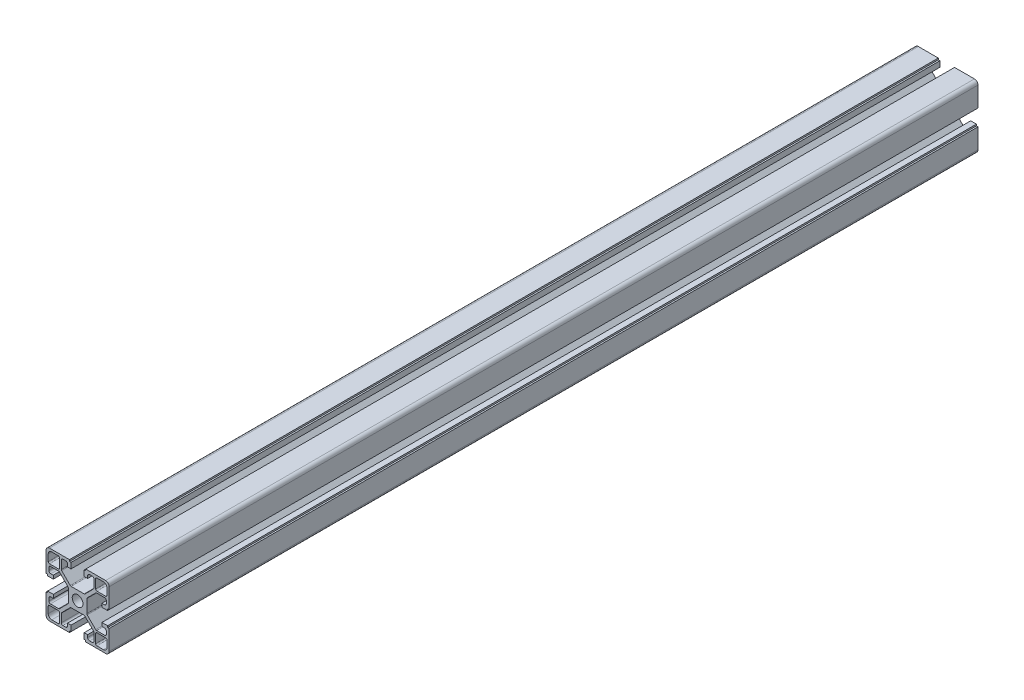
from build123d import *

# Parameters (mm, degrees)
SKETCH1_R           = 3.4
BOSS_EXTRUDE1_DEPTH = 713
SKETCH2_W           = 40
SKETCH2_H           = 163
CUT_EXTRUDE1_DEPTH  = 715.401147815


with BuildPart() as part:
    # Sketch1 → Boss-Extrude1 (new body)
    with BuildSketch(Plane.XY):
        with BuildLine():
            Line((20, 17.75), (20, 5.15))
            Line((20, 5.15), (19, 5.15))
            Line((19, 5.15), (19, 4.15))
            Line((19, 4.15), (15.4, 4.15))
            Line((15.4, 4.15), (15.4, 6.35))
            Line((15.4, 6.35), (16.95, 6.35))
            ThreePointArc((16.95, 6.35), (17.833883476, 6.716116524), (18.2, 7.6))
            Line((18.2, 7.6), (18.2, 9.3))
            ThreePointArc((18.2, 9.3), (17.907106781, 10.007106781), (17.2, 10.3))
            Line((17.2, 10.3), (12.03669957, 10.3))
            ThreePointArc((12.03669957, 10.3), (11.73040037, 10.239040459), (11.470780817, 10.065452001))
            Line((11.470780817, 10.065452001), (6.084081247, 4.674305984))
            ThreePointArc((6.084081247, 4.674305984), (5.910833239, 4.414848262), (5.85, 4.108853983))
            Line((5.85, 4.108853983), (5.85, -4.108853983))
            ThreePointArc((5.85, -4.108853983), (5.910833239, -4.414848262), (6.084081247, -4.674305984))
            Line((6.084081247, -4.674305984), (11.470780817, -10.065452001))
            ThreePointArc((11.470780817, -10.065452001), (11.73040037, -10.239040459), (12.03669957, -10.3))
            Line((12.03669957, -10.3), (17.2, -10.3))
            ThreePointArc((17.2, -10.3), (17.907106781, -10.007106781), (18.2, -9.3))
            Line((18.2, -9.3), (18.2, -7.6))
            ThreePointArc((18.2, -7.6), (17.833883476, -6.716116524), (16.95, -6.35))
            Line((16.95, -6.35), (15.4, -6.35))
            Line((15.4, -6.35), (15.4, -4.15))
            Line((15.4, -4.15), (19, -4.15))
            Line((19, -4.15), (19, -5.15))
            Line((19, -5.15), (20, -5.15))
            Line((20, -5.15), (20, -17.75))
            ThreePointArc((20, -17.75), (19.340990258, -19.340990258), (17.75, -20))
            Line((17.75, -20), (5.15, -20))
            Line((5.15, -20), (5.15, -19))
            Line((5.15, -19), (4.15, -19))
            Line((4.15, -19), (4.15, -15.4))
            Line((4.15, -15.4), (6.35, -15.4))
            Line((6.35, -15.4), (6.35, -16.95))
            ThreePointArc((6.35, -16.95), (6.716116524, -17.833883476), (7.6, -18.2))
            Line((7.6, -18.2), (9.3, -18.2))
            ThreePointArc((9.3, -18.2), (10.007106781, -17.907106781), (10.3, -17.2))
            Line((10.3, -17.2), (10.3, -12.054477022))
            ThreePointArc((10.3, -12.054477022), (10.239166761, -11.748482743), (10.065918753, -11.489025021))
            Line((10.065918753, -11.489025021), (4.665899173, -6.084547999))
            ThreePointArc((4.665899173, -6.084547999), (4.406279619, -5.910959541), (4.09998042, -5.85))
            Line((4.09998042, -5.85), (-4.09998042, -5.85))
            ThreePointArc((-4.09998042, -5.85), (-4.406279619, -5.910959541), (-4.665899173, -6.084547999))
            Line((-4.665899173, -6.084547999), (-10.065918753, -11.489025021))
            ThreePointArc((-10.065918753, -11.489025021), (-10.239166761, -11.748482743), (-10.3, -12.054477022))
            Line((-10.3, -12.054477022), (-10.3, -17.2))
            ThreePointArc((-10.3, -17.2), (-10.007106781, -17.907106781), (-9.3, -18.2))
            Line((-9.3, -18.2), (-7.6, -18.2))
            ThreePointArc((-7.6, -18.2), (-6.716116524, -17.833883476), (-6.35, -16.95))
            Line((-6.35, -16.95), (-6.35, -15.4))
            Line((-6.35, -15.4), (-4.15, -15.4))
            Line((-4.15, -15.4), (-4.15, -19))
            Line((-4.15, -19), (-5.15, -19))
            Line((-5.15, -19), (-5.15, -20))
            Line((-5.15, -20), (-17.75, -20))
            ThreePointArc((-17.75, -20), (-19.340990258, -19.340990258), (-20, -17.75))
            Line((-20, -17.75), (-20, -5.15))
            Line((-20, -5.15), (-19, -5.15))
            Line((-19, -5.15), (-19, -4.15))
            Line((-19, -4.15), (-15.4, -4.15))
            Line((-15.4, -4.15), (-15.4, -6.35))
            Line((-15.4, -6.35), (-16.95, -6.35))
            ThreePointArc((-16.95, -6.35), (-17.833883476, -6.716116524), (-18.2, -7.6))
            Line((-18.2, -7.6), (-18.2, -9.3))
            ThreePointArc((-18.2, -9.3), (-17.907106781, -10.007106781), (-17.2, -10.3))
            Line((-17.2, -10.3), (-12.03669957, -10.3))
            ThreePointArc((-12.03669957, -10.3), (-11.73040037, -10.239040459), (-11.470780817, -10.065452001))
            Line((-11.470780817, -10.065452001), (-6.084081247, -4.674305984))
            ThreePointArc((-6.084081247, -4.674305984), (-5.910833239, -4.414848262), (-5.85, -4.108853983))
            Line((-5.85, -4.108853983), (-5.85, 4.108853983))
            ThreePointArc((-5.85, 4.108853983), (-5.910833239, 4.414848262), (-6.084081247, 4.674305984))
            Line((-6.084081247, 4.674305984), (-11.470780817, 10.065452001))
            ThreePointArc((-11.470780817, 10.065452001), (-11.73040037, 10.239040459), (-12.03669957, 10.3))
            Line((-12.03669957, 10.3), (-17.2, 10.3))
            ThreePointArc((-17.2, 10.3), (-17.907106781, 10.007106781), (-18.2, 9.3))
            Line((-18.2, 9.3), (-18.2, 7.6))
            ThreePointArc((-18.2, 7.6), (-17.833883476, 6.716116524), (-16.95, 6.35))
            Line((-16.95, 6.35), (-15.4, 6.35))
            Line((-15.4, 6.35), (-15.4, 4.15))
            Line((-15.4, 4.15), (-19, 4.15))
            Line((-19, 4.15), (-19, 5.15))
            Line((-19, 5.15), (-20, 5.15))
            Line((-20, 5.15), (-20, 17.75))
            ThreePointArc((-20, 17.75), (-19.340990258, 19.340990258), (-17.75, 20))
            Line((-17.75, 20), (-5.15, 20))
            Line((-5.15, 20), (-5.15, 19))
            Line((-5.15, 19), (-4.15, 19))
            Line((-4.15, 19), (-4.15, 15.4))
            Line((-4.15, 15.4), (-6.35, 15.4))
            Line((-6.35, 15.4), (-6.35, 16.95))
            ThreePointArc((-6.35, 16.95), (-6.716116524, 17.833883476), (-7.6, 18.2))
            Line((-7.6, 18.2), (-9.3, 18.2))
            ThreePointArc((-9.3, 18.2), (-10.007106781, 17.907106781), (-10.3, 17.2))
            Line((-10.3, 17.2), (-10.3, 12.054477022))
            ThreePointArc((-10.3, 12.054477022), (-10.239166761, 11.748482743), (-10.065918753, 11.489025021))
            Line((-10.065918753, 11.489025021), (-4.665899173, 6.084547999))
            ThreePointArc((-4.665899173, 6.084547999), (-4.406279619, 5.910959541), (-4.09998042, 5.85))
            Line((-4.09998042, 5.85), (4.09998042, 5.85))
            ThreePointArc((4.09998042, 5.85), (4.406279619, 5.910959541), (4.665899173, 6.084547999))
            Line((4.665899173, 6.084547999), (10.065918753, 11.489025021))
            ThreePointArc((10.065918753, 11.489025021), (10.239166761, 11.748482743), (10.3, 12.054477022))
            Line((10.3, 12.054477022), (10.3, 17.2))
            ThreePointArc((10.3, 17.2), (10.007106781, 17.907106781), (9.3, 18.2))
            Line((9.3, 18.2), (7.6, 18.2))
            ThreePointArc((7.6, 18.2), (6.716116524, 17.833883476), (6.35, 16.95))
            Line((6.35, 16.95), (6.35, 15.4))
            Line((6.35, 15.4), (4.15, 15.4))
            Line((4.15, 15.4), (4.15, 19))
            Line((4.15, 19), (5.15, 19))
            Line((5.15, 19), (5.15, 20))
            Line((5.15, 20), (17.75, 20))
            ThreePointArc((17.75, 20), (19.340990258, 19.340990258), (20, 17.75))
        make_face()
        with Locations(Location((0, 0, 0), (0, 0, 180))):
            Circle(SKETCH1_R, mode=Mode.SUBTRACT)
        with BuildLine():
            Line((18.6, 16.35), (18.6, 12.2))
            ThreePointArc((18.6, 12.2), (18.365685425, 11.634314575), (17.8, 11.4))
            Line((17.8, 11.4), (12.2, 11.4))
            ThreePointArc((12.2, 11.4), (11.634314575, 11.634314575), (11.4, 12.2))
            Line((11.4, 12.2), (11.4, 17.8))
            ThreePointArc((11.4, 17.8), (11.634314575, 18.365685425), (12.2, 18.6))
            Line((12.2, 18.6), (16.35, 18.6))
            ThreePointArc((16.35, 18.6), (17.940990258, 17.940990258), (18.6, 16.35))
        make_face(mode=Mode.SUBTRACT)
        with BuildLine():
            Line((-12.2, 18.6), (-16.35, 18.6))
            ThreePointArc((-16.35, 18.6), (-17.940990258, 17.940990258), (-18.6, 16.35))
            Line((-18.6, 16.35), (-18.6, 12.2))
            ThreePointArc((-18.6, 12.2), (-18.365685425, 11.634314575), (-17.8, 11.4))
            Line((-17.8, 11.4), (-12.2, 11.4))
            ThreePointArc((-12.2, 11.4), (-11.634314575, 11.634314575), (-11.4, 12.2))
            Line((-11.4, 12.2), (-11.4, 17.8))
            ThreePointArc((-11.4, 17.8), (-11.634314575, 18.365685425), (-12.2, 18.6))
        make_face(mode=Mode.SUBTRACT)
        with BuildLine():
            Line((-18.6, -16.35), (-18.6, -12.2))
            ThreePointArc((-18.6, -12.2), (-18.365685425, -11.634314575), (-17.8, -11.4))
            Line((-17.8, -11.4), (-12.2, -11.4))
            ThreePointArc((-12.2, -11.4), (-11.634314575, -11.634314575), (-11.4, -12.2))
            Line((-11.4, -12.2), (-11.4, -17.8))
            ThreePointArc((-11.4, -17.8), (-11.634314575, -18.365685425), (-12.2, -18.6))
            Line((-12.2, -18.6), (-16.35, -18.6))
            ThreePointArc((-16.35, -18.6), (-17.940990258, -17.940990258), (-18.6, -16.35))
        make_face(mode=Mode.SUBTRACT)
        with BuildLine():
            Line((12.2, -18.6), (16.35, -18.6))
            ThreePointArc((16.35, -18.6), (17.940990258, -17.940990258), (18.6, -16.35))
            Line((18.6, -16.35), (18.6, -12.2))
            ThreePointArc((18.6, -12.2), (18.365685425, -11.634314575), (17.8, -11.4))
            Line((17.8, -11.4), (12.2, -11.4))
            ThreePointArc((12.2, -11.4), (11.634314575, -11.634314575), (11.4, -12.2))
            Line((11.4, -12.2), (11.4, -17.8))
            ThreePointArc((11.4, -17.8), (11.634314575, -18.365685425), (12.2, -18.6))
        make_face(mode=Mode.SUBTRACT)
    extrude(amount=BOSS_EXTRUDE1_DEPTH)

    # Sketch2 → Cut-Extrude1 (cut, through all)
    with BuildSketch(Plane(origin=(0, 20, 0), x_dir=(1, 0, 0), z_dir=(0, 1, 0))):
        with Locations((0, -631.5)):
            Rectangle(SKETCH2_W, SKETCH2_H)
    extrude(amount=-CUT_EXTRUDE1_DEPTH, mode=Mode.SUBTRACT)


solid = part.part
